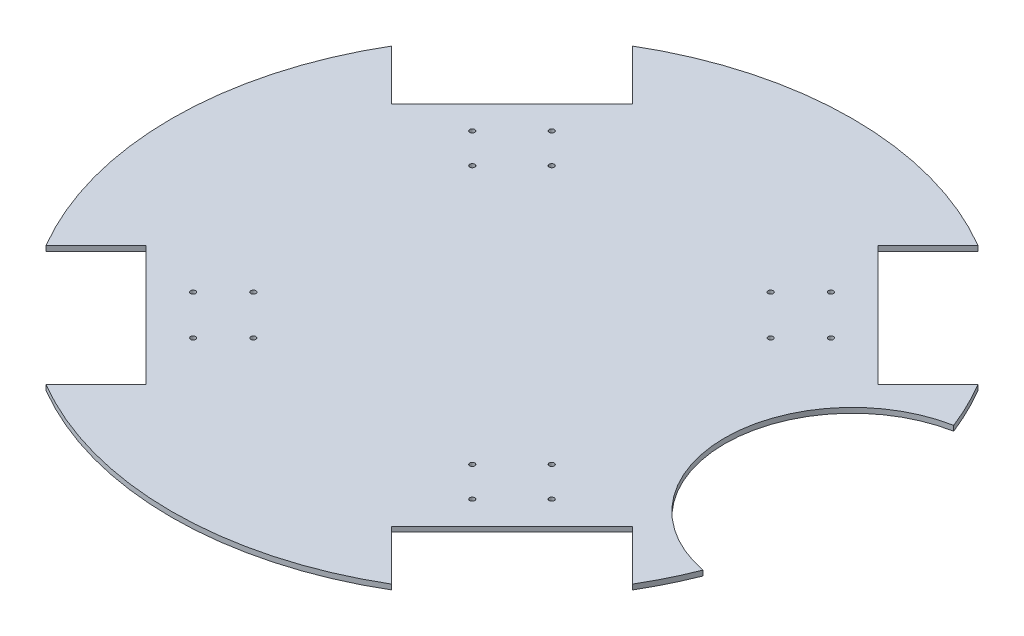
from build123d import *

# Parameters (mm, degrees)
SKETCH1_R           = 200
BOSS_EXTRUDE1_DEPTH = 3
CUT_EXTRUDE1_DEPTH  = 3
SKETCH3_R           = 75
CUT_EXTRUDE2_DEPTH  = 10
SKETCH5_R           = 1.5
CUT_EXTRUDE4_DEPTH  = 73


with BuildPart() as part:
    # Sketch1 → Boss-Extrude1 (new body)
    with BuildSketch(Plane(origin=(0, 0, 0), x_dir=(1, 0, 0), z_dir=(0, 1, 0))):
        with Locations(Location((0, 0, 0), (0, 0, 270))):
            Circle(SKETCH1_R)
    extrude(amount=BOSS_EXTRUDE1_DEPTH)

    # Sketch2 → Cut-Extrude1 (cut)
    with BuildSketch(Plane(origin=(0, 3, 0), x_dir=(1, 0, 0), z_dir=(0, 1, 0))):
        Polygon((-142.885155346, -72.174477228), (-72.174477228, -142.885155346), (-156.069019709, -226.779697828), (-226.779697828, -156.069019709), align=None)
        Polygon((-72.174477228, 142.885155346), (-142.885155346, 72.174477228), (-226.779697828, 156.069019709), (-156.069019709, 226.779697828), align=None)
        Polygon((142.885155346, 72.174477228), (72.174477228, 142.885155346), (156.069019709, 226.779697828), (226.779697828, 156.069019709), align=None)
        Polygon((72.174477228, -142.885155346), (142.885155346, -72.174477228), (226.779697828, -156.069019709), (156.069019709, -226.779697828), align=None)
    extrude(amount=-CUT_EXTRUDE1_DEPTH, mode=Mode.SUBTRACT)

    # Sketch3 → Cut-Extrude2 (cut)
    with BuildSketch(Plane(origin=(0, 3, 0), x_dir=(1, 0, 0), z_dir=(0, 1, 0))):
        with Locations((200, 0)):
            Circle(SKETCH3_R)
    extrude(amount=-CUT_EXTRUDE2_DEPTH, mode=Mode.SUBTRACT)

    # Sketch5 → Cut-Extrude4 (cut)
    with BuildSketch(Plane(origin=(0, 3, 0), x_dir=(1, 0, 0), z_dir=(0, 1, 0))):
        with Locations(Location((82.031457685, -105.365981465, 0), (0, 0, 270))):
            Circle(SKETCH5_R)
        with Locations(Location((64.33964602, -87.674169799, 0), (0, 0, 270))):
            Circle(SKETCH5_R)
        with Locations(Location((105.365981465, -82.031457685, 0), (0, 0, 270))):
            Circle(SKETCH5_R)
        with Locations(Location((87.674169799, -64.33964602, 0), (0, 0, 270))):
            Circle(SKETCH5_R)
        with Locations(Location((-87.674169799, -64.33964602, 0), (0, 0, 270))):
            Circle(SKETCH5_R)
        with Locations(Location((-105.365981465, -82.031457685, 0), (0, 0, 270))):
            Circle(SKETCH5_R)
        with Locations(Location((-82.031457685, -105.365981465, 0), (0, 0, 270))):
            Circle(SKETCH5_R)
        with Locations(Location((-64.33964602, -87.674169799, 0), (0, 0, 270))):
            Circle(SKETCH5_R)
        with Locations(Location((-64.33964602, 87.674169799, 0), (0, 0, 270))):
            Circle(SKETCH5_R)
        with Locations(Location((-82.031457685, 105.365981465, 0), (0, 0, 270))):
            Circle(SKETCH5_R)
        with Locations(Location((-105.365981465, 82.031457685, 0), (0, 0, 270))):
            Circle(SKETCH5_R)
        with Locations(Location((-87.674169799, 64.33964602, 0), (0, 0, 270))):
            Circle(SKETCH5_R)
        with Locations(Location((87.674169799, 64.33964602, 0), (0, 0, 270))):
            Circle(SKETCH5_R)
        with Locations(Location((105.365981465, 82.031457685, 0), (0, 0, 270))):
            Circle(SKETCH5_R)
        with Locations(Location((82.031457685, 105.365981465, 0), (0, 0, 270))):
            Circle(SKETCH5_R)
        with Locations(Location((64.33964602, 87.674169799, 0), (0, 0, 270))):
            Circle(SKETCH5_R)
    extrude(amount=-CUT_EXTRUDE4_DEPTH, mode=Mode.SUBTRACT)


solid = part.part
